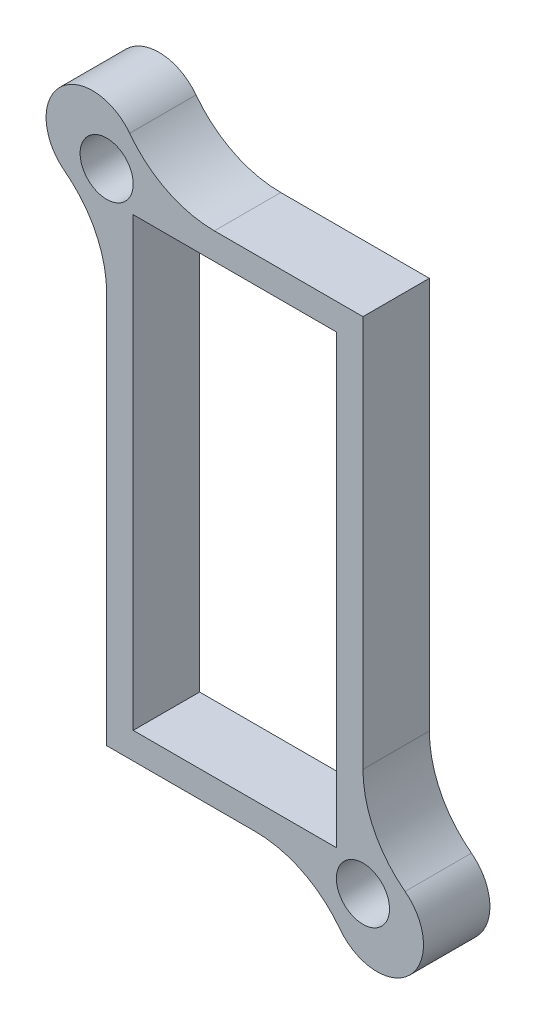
from build123d import *
from build123d.topology import SkipClean

# Parameters (mm, degrees)
SKETCH3_W           = 9.65
SKETCH3_H           = 18.81667
SKETCH3_W_2         = 7.65
SKETCH3_H_2         = 16.81667
EXTRUDE_THIN1_DEPTH = 2.5
BOSS_EXTRUDE2_DEPTH = 2.5
CUT_EXTRUDE1_DEPTH  = 2.5
FILLET1_R           = 4


with BuildPart() as part:
    # Sketch3 → Extrude-Thin1 (new body)
    with BuildSketch(Plane.XY):
        with Locations((10.605490461, -24)):
            Rectangle(SKETCH3_W, SKETCH3_H)
        with Locations((10.605490461, -24)):
            Rectangle(SKETCH3_W_2, SKETCH3_H_2, mode=Mode.SUBTRACT)
    extrude(amount=EXTRUDE_THIN1_DEPTH)

    # Sketch4 → Boss-Extrude2 (add)
    with BuildSketch(Plane.XY.offset(2.5)):
        with BuildLine():
            ThreePointArc((5.780490461, -15.591665), (5.07338368, -13.884558219), (6.780490461, -14.591665))
            Line((6.780490461, -14.591665), (6.917868383, -14.591665))
            ThreePointArc((6.917868383, -14.591665), (6.979465006, -14.329673307), (7.000160375, -14.061334914))
            ThreePointArc((7.000160375, -14.061334914), (3.837613447, -13.02827578), (5.780490461, -15.729042922))
            Line((5.780490461, -15.729042922), (5.780490461, -15.591665))
        make_face()
        with BuildLine():
            ThreePointArc((17.710820547, -33.938665086), (16.993879681, -32.526118157), (15.430490461, -32.270957078))
            Line((15.430490461, -32.270957078), (15.430490461, -32.408335))
            ThreePointArc((15.430490461, -32.408335), (16.137597242, -32.701228219), (16.430490461, -33.408335))
            ThreePointArc((16.430490461, -33.408335), (15.430490461, -34.408335), (14.430490461, -33.408335))
            Line((14.430490461, -33.408335), (14.293112539, -33.408335))
            ThreePointArc((14.293112539, -33.408335), (15.692482154, -35.667969717), (17.710820547, -33.938665086))
        make_face()
    extrude(amount=-BOSS_EXTRUDE2_DEPTH)

    # Sketch4<2> → Cut-Extrude1 (cut)
    with SkipClean():  # the faces are left unmerged after this step: merging them gives an invalid solid
        with BuildSketch(Plane.XY.offset(2.5)):
            with BuildLine():
                Line((5.780490461, -14.591665), (6.780490461, -14.591665))
                ThreePointArc((6.780490461, -14.591665), (5.07338368, -13.884558219), (5.780490461, -15.591665))
                Line((5.780490461, -15.591665), (5.780490461, -14.591665))
            make_face()
            with BuildLine():
                ThreePointArc((6.487597245, -15.298771778), (6.704369994, -14.97434843), (6.780490461, -14.591665))
                Line((6.780490461, -14.591665), (5.780490461, -14.591665))
                Line((5.780490461, -14.591665), (5.780490461, -15.591665))
                ThreePointArc((5.780490461, -15.591665), (6.163173895, -15.515544532), (6.487597245, -15.298771778))
            make_face()
            with BuildLine():
                ThreePointArc((15.430490461, -32.408335), (15.047807029, -32.484455467), (14.72338368, -32.701228219))
                ThreePointArc((14.72338368, -32.701228219), (14.506610928, -33.025651568), (14.430490461, -33.408335))
                Line((14.430490461, -33.408335), (15.430490461, -33.408335))
                Line((15.430490461, -33.408335), (15.430490461, -32.408335))
            make_face()
            with BuildLine():
                ThreePointArc((16.430490461, -33.408335), (16.137597242, -32.701228219), (15.430490461, -32.408335))
                Line((15.430490461, -32.408335), (15.430490461, -33.408335))
                Line((15.430490461, -33.408335), (14.430490461, -33.408335))
                ThreePointArc((14.430490461, -33.408335), (15.430490461, -34.408335), (16.430490461, -33.408335))
            make_face()
        extrude(amount=-CUT_EXTRUDE1_DEPTH, mode=Mode.SUBTRACT)

    # Fillet1
    fillet1_edges = [part.edges().sort_by_distance(p)[0] for p in [
        (6.917868383, -14.591665, 1.25),
        (5.780490461, -15.729042922, 1.25),
        (14.293112539, -33.408335, 1.25),
        (15.430490461, -32.270957078, 1.25),
    ]]
    fillet(fillet1_edges, radius=FILLET1_R)


solid = part.part
